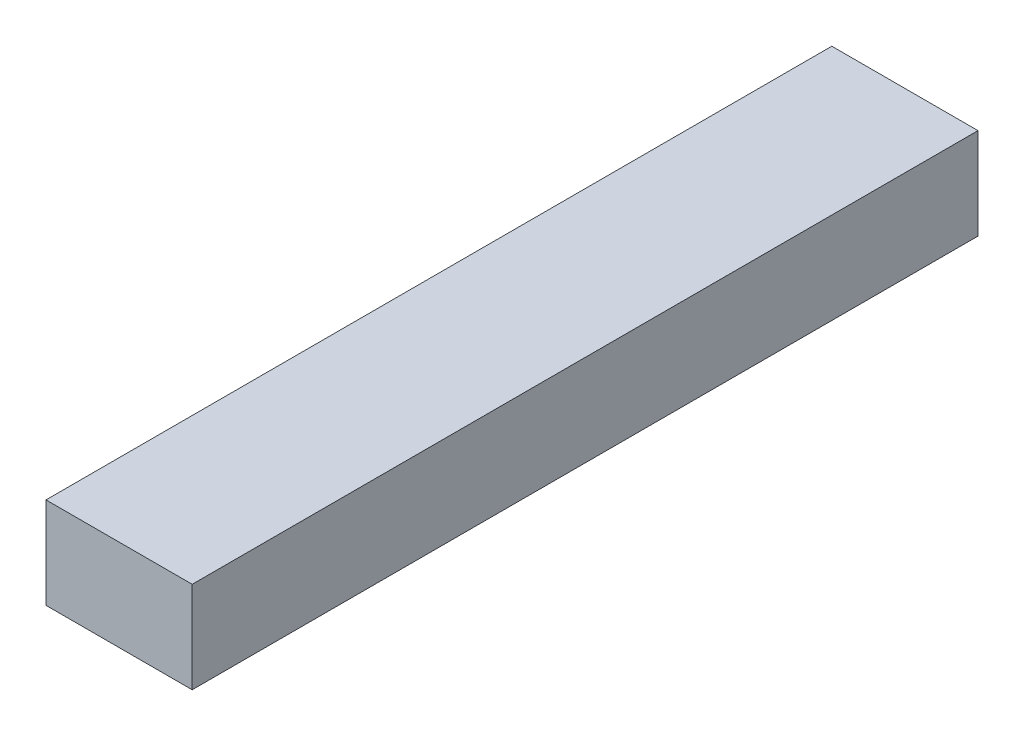
from build123d import *

# Parameters (mm, degrees)
SKETCH1_W           = 16
SKETCH1_H           = 10
BOSS_EXTRUDE1_DEPTH = 86


with BuildPart() as part:
    # Sketch1 → Boss-Extrude1 (new body)
    with BuildSketch(Plane.XY):
        Rectangle(SKETCH1_W, SKETCH1_H)
    extrude(amount=BOSS_EXTRUDE1_DEPTH)


solid = part.part
